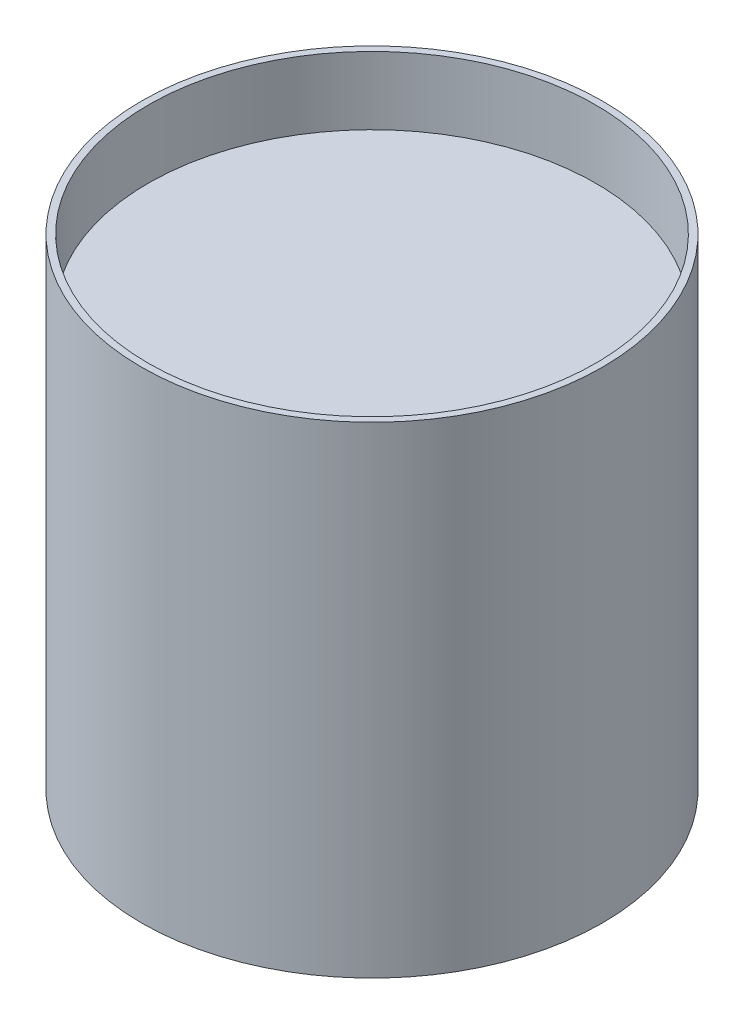
from build123d import *

# Parameters (mm, degrees)
SKETCH1_R           = 34
SKETCH1_R_2         = 33
BOSS_EXTRUDE1_DEPTH = 71
SKETCH2_W           = 33
SKETCH2_H           = 51


with BuildPart() as part:
    # Sketch1 → Boss-Extrude1 (new body)
    with BuildSketch(Plane(origin=(0, 0, 0), x_dir=(1, 0, 0), z_dir=(0, 1, 0))):
        Circle(SKETCH1_R)
        Circle(SKETCH1_R_2, mode=Mode.SUBTRACT)
    extrude(amount=BOSS_EXTRUDE1_DEPTH)

    # Sketch2 → Revolve1 (revolve)
    with BuildSketch(Plane.XY):
        with Locations((-16.5, 35.5)):
            Rectangle(SKETCH2_W, SKETCH2_H)
    revolve(axis=Axis((0, 61, 0), (0, -1, 0)))


solid = part.part
